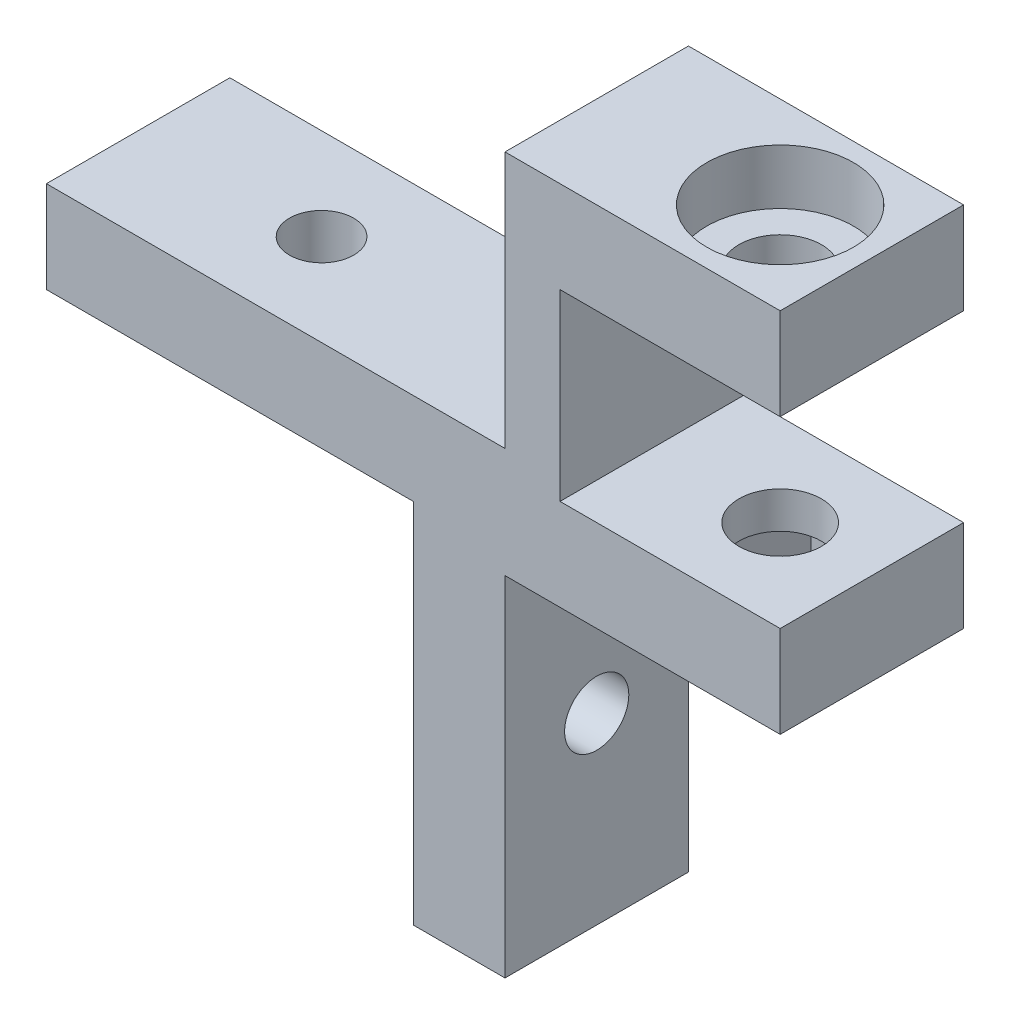
from build123d import *

# Parameters (mm, degrees)
SKETCH2_W                                           = 25
SKETCH2_H                                           = 25
BOSS_EXTRUDE1_DEPTH                                 = 10
SKETCH3_W                                           = 20
SKETCH3_H                                           = 20
CUT_EXTRUDE1_DEPTH                                  = 21.310096012
SKETCH5_W                                           = 10
SKETCH5_H                                           = 20
BOSS_EXTRUDE2_DEPTH                                 = 15
SKETCH7_W                                           = 12
SKETCH7_H                                           = 10
CUT_EXTRUDE2_DEPTH                                  = 40.477841886
SKETCH8_R                                           = 2.25
CUT_EXTRUDE3_DEPTH                                  = 49.757050772
SKETCH9_R                                           = 1.75
CUT_EXTRUDE4_DEPTH                                  = 15
SKETCH10_R                                          = 1.75
CUT_EXTRUDE5_DEPTH                                  = 15
CBORE_FOR_M4_HEX_SOCKET_HEAD_CAP_SCREW1_D           = 4.5
CBORE_FOR_M4_HEX_SOCKET_HEAD_CAP_SCREW1_CBORE_D     = 8
CBORE_FOR_M4_HEX_SOCKET_HEAD_CAP_SCREW1_CBORE_DEPTH = 3
CUT_EXTRUDE6_DEPTH                                  = 3


with BuildPart() as part:
    # Sketch2 → Boss-Extrude1 (new body)
    with BuildSketch(Plane.XY):
        Rectangle(SKETCH2_W, SKETCH2_H)
    extrude(amount=BOSS_EXTRUDE1_DEPTH)

    # Sketch3 → Cut-Extrude1 (cut, through all)
    with BuildSketch(Plane.XY.offset(10)):
        with Locations((-2.5, -2.5)):
            Rectangle(SKETCH3_W, SKETCH3_H)
    extrude(amount=-CUT_EXTRUDE1_DEPTH, mode=Mode.SUBTRACT)

    # Sketch5 → Boss-Extrude2 (add)
    with BuildSketch(Plane(origin=(12.5, 0, 0), x_dir=(0, 0, -1), z_dir=(1, 0, 0))):
        with Locations((-5, 16.5)):
            Rectangle(SKETCH5_W, SKETCH5_H)
    extrude(amount=BOSS_EXTRUDE2_DEPTH)

    # Sketch7 → Cut-Extrude2 (cut, through all)
    with BuildSketch(Plane.XY.offset(10)):
        with Locations((21.5, 16.5)):
            Rectangle(SKETCH7_W, SKETCH7_H)
    extrude(amount=-CUT_EXTRUDE2_DEPTH, mode=Mode.SUBTRACT)

    # Sketch8 → Cut-Extrude3 (cut, through all)
    with BuildSketch(Plane(origin=(0, 26.5, 0), x_dir=(1, 0, 0), z_dir=(0, 1, 0))):
        with Locations(Location((22.5, -5, 0), (0, 0, 270))):
            Circle(SKETCH8_R)
    extrude(amount=-CUT_EXTRUDE3_DEPTH, mode=Mode.SUBTRACT)

    # Sketch9 → Cut-Extrude4 (cut)
    with BuildSketch(Plane(origin=(0, 12.5, 0), x_dir=(1, 0, 0), z_dir=(0, 1, 0))):
        with Locations(Location((-2.5, -5, 0), (0, 0, 270))):
            Circle(SKETCH9_R)
    extrude(amount=-CUT_EXTRUDE4_DEPTH, mode=Mode.SUBTRACT)

    # Sketch10 → Cut-Extrude5 (cut)
    with BuildSketch(Plane(origin=(12.5, 0, 0), x_dir=(0, 0, -1), z_dir=(1, 0, 0))):
        with Locations((-5, -2.5)):
            Circle(SKETCH10_R)
    extrude(amount=-CUT_EXTRUDE5_DEPTH, mode=Mode.SUBTRACT)

    # CBORE for M4 Hex Socket Head Cap Screw1 (through all)
    with Locations(Plane(origin=(0, 26.5, 0), x_dir=(1, 0, 0), z_dir=(0, 1, 0))):
        with Locations((22.5, -5)):
            CounterBoreHole(CBORE_FOR_M4_HEX_SOCKET_HEAD_CAP_SCREW1_D / 2, CBORE_FOR_M4_HEX_SOCKET_HEAD_CAP_SCREW1_CBORE_D / 2, CBORE_FOR_M4_HEX_SOCKET_HEAD_CAP_SCREW1_CBORE_DEPTH)

    # Sketch13 → Cut-Extrude6 (cut)
    with BuildSketch(Plane.XZ.offset(-6.5)):
        Polygon((17.881197846, 5), (20.190598923, 1), (24.809401077, 1), (27.118802154, 5), (24.809401077, 9), (20.190598923, 9), align=None)
    extrude(amount=-CUT_EXTRUDE6_DEPTH, mode=Mode.SUBTRACT)


solid = part.part
